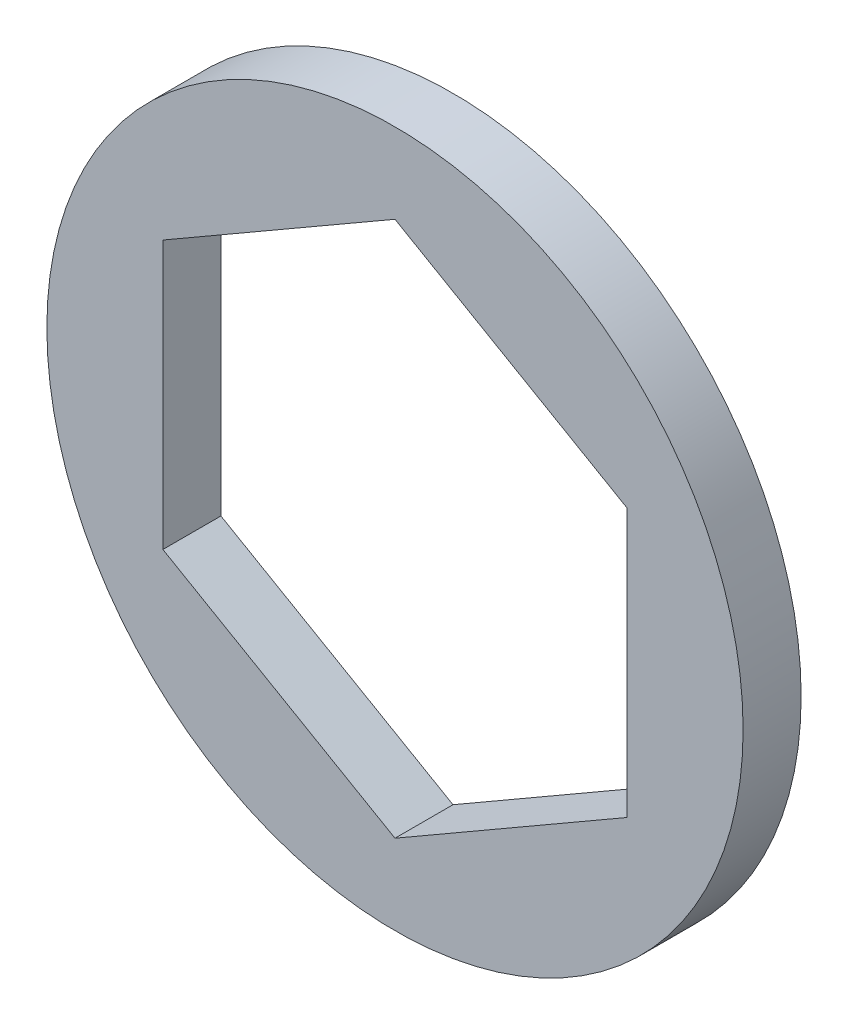
from build123d import *

# Parameters (mm, degrees)
SKETCH1_R           = 9.525
BOSS_EXTRUDE1_DEPTH = 0.79375


with BuildPart() as part:
    # Sketch1 → Boss-Extrude1 (new, symmetric)
    with BuildSketch(Plane.XY):
        Circle(SKETCH1_R)
        Polygon((0, 7.332348419), (-6.35, 3.666174209), (-6.35, -3.666174209), (0, -7.332348419), (6.35, -3.666174209), (6.35, 3.666174209), align=None, mode=Mode.SUBTRACT)
    extrude(amount=BOSS_EXTRUDE1_DEPTH, both=True)


solid = part.part
